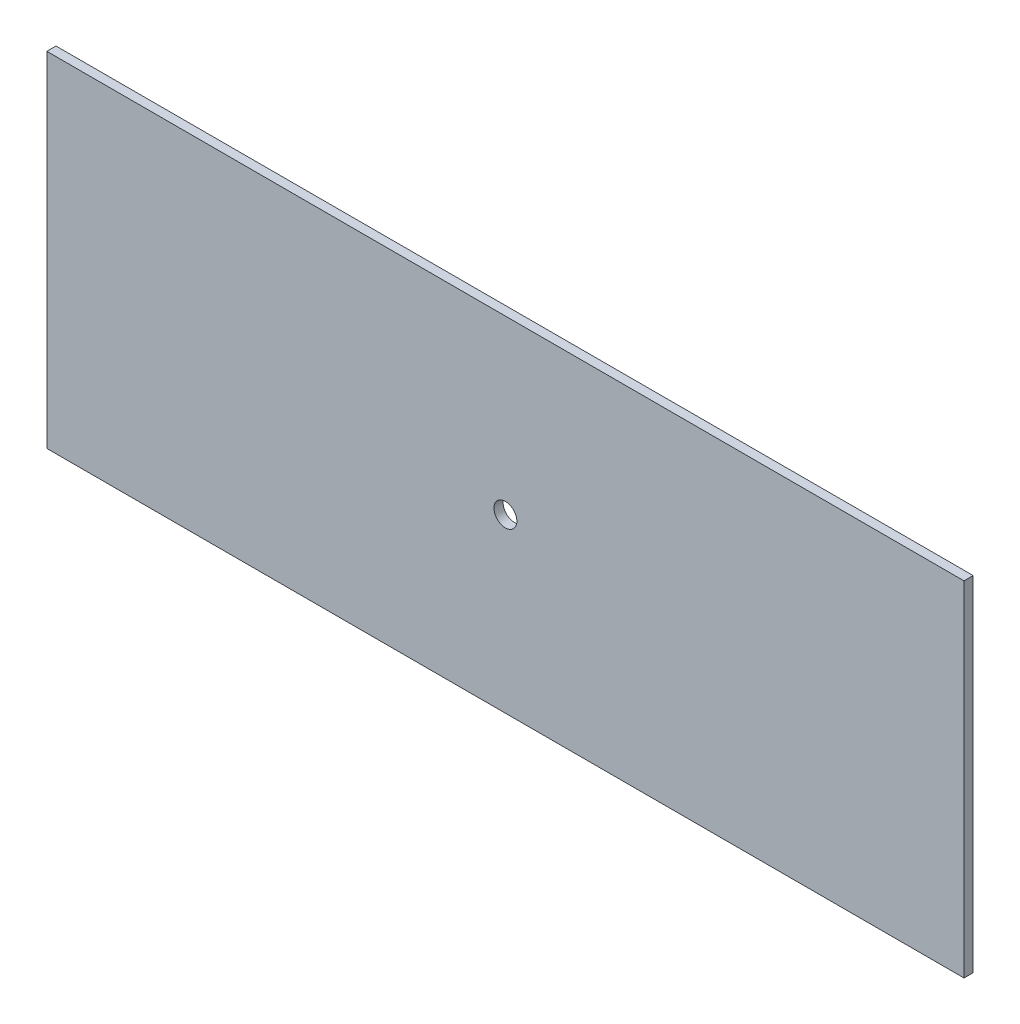
from build123d import *

# Parameters (mm, degrees)
SKETCH1_W           = 400
SKETCH1_H           = 150
SKETCH1_R           = 5
BOSS_EXTRUDE1_DEPTH = 4


with BuildPart() as part:
    # Sketch1 → Boss-Extrude1 (new body)
    with BuildSketch(Plane.XY):
        with Locations((200, -75)):
            Rectangle(SKETCH1_W, SKETCH1_H)
        with Locations((200, -75)):
            Circle(SKETCH1_R, mode=Mode.SUBTRACT)
    extrude(amount=BOSS_EXTRUDE1_DEPTH)


solid = part.part
